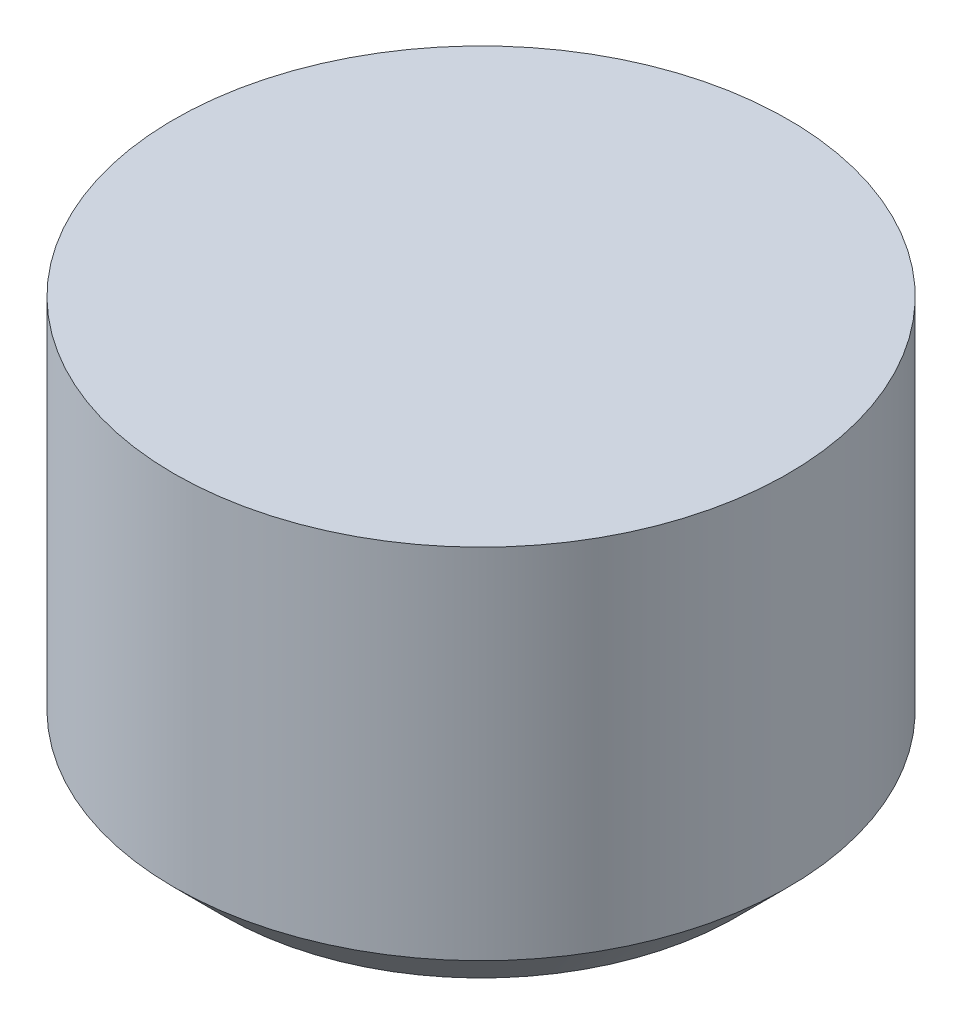
from build123d import *

# Parameters (mm, degrees)
SKETCH1_R           = 9
BOSS_EXTRUDE2_DEPTH = 12
CHAMFER1_SIZE       = 1.5


with BuildPart() as part:
    # Sketch1 → Boss-Extrude2 (new body)
    with BuildSketch(Plane(origin=(0, 0, 0), x_dir=(1, 0, 0), z_dir=(0, 1, 0))):
        with Locations(Location((0, 0, 0), (0, 0, 270))):
            Circle(SKETCH1_R)
    extrude(amount=BOSS_EXTRUDE2_DEPTH)

    # Chamfer1
    chamfer1_edges = [part.edges().sort_by_distance(p)[0] for p in [
        (0, 0, -9),
    ]]
    chamfer(chamfer1_edges, length=CHAMFER1_SIZE)


solid = part.part
